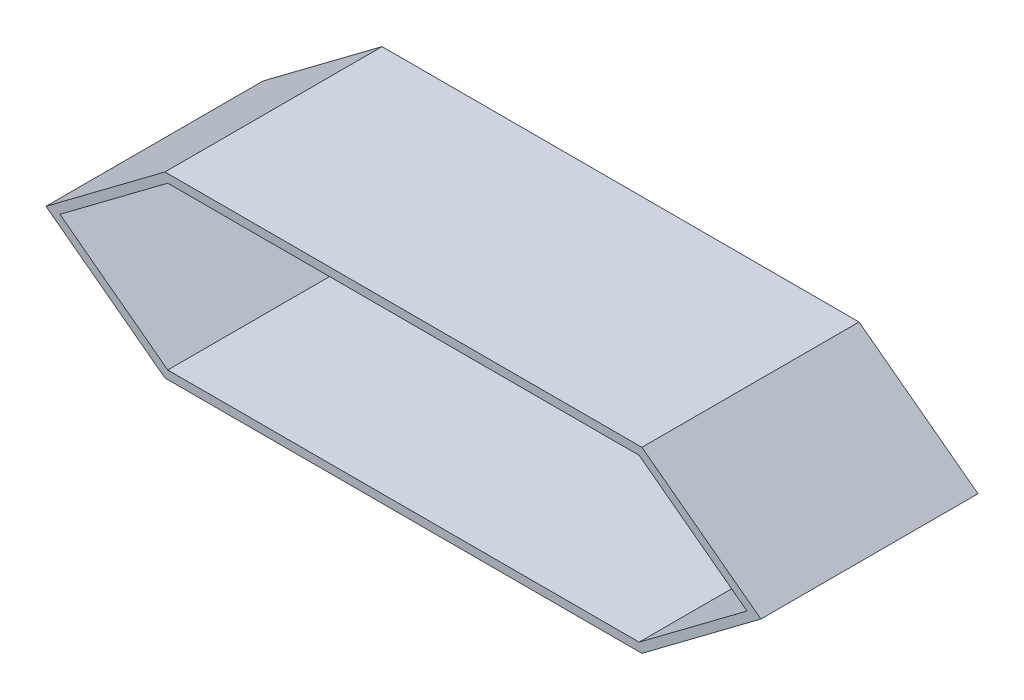
from build123d import *

# Parameters (mm, degrees)
BOSS_EXTRU_1_DEPTH = 0.8
BOSS_EXTRU_2_DEPTH = 20


with BuildPart() as part:
    # Esquisse1 → Boss.-Extru.1 (new body)
    with BuildSketch(Plane.XY):
        Polygon((22.85, 64.904088569), (-22.85, 64.904088569), (-34.25, 56.354088569), (-22.85, 47.804088569), (22.85, 47.804088569), (34.25, 56.354088569), align=None)
    extrude(amount=BOSS_EXTRU_1_DEPTH)

    # Esquisse2 → Boss.-Extru.2 (add)
    with BuildSketch(Plane.XY.offset(0.8)):
        Polygon((34.25, 56.354088569), (22.85, 64.904088569), (-22.85, 64.904088569), (-34.25, 56.354088569), (-22.85, 47.804088569), (22.85, 47.804088569), align=None)
        Polygon((-22.583333333, 64.104088569), (-32.916666667, 56.354088569), (-22.583333333, 48.604088569), (22.583333333, 48.604088569), (32.916666667, 56.354088569), (22.583333333, 64.104088569), align=None, mode=Mode.SUBTRACT)
    extrude(amount=BOSS_EXTRU_2_DEPTH)


solid = part.part
